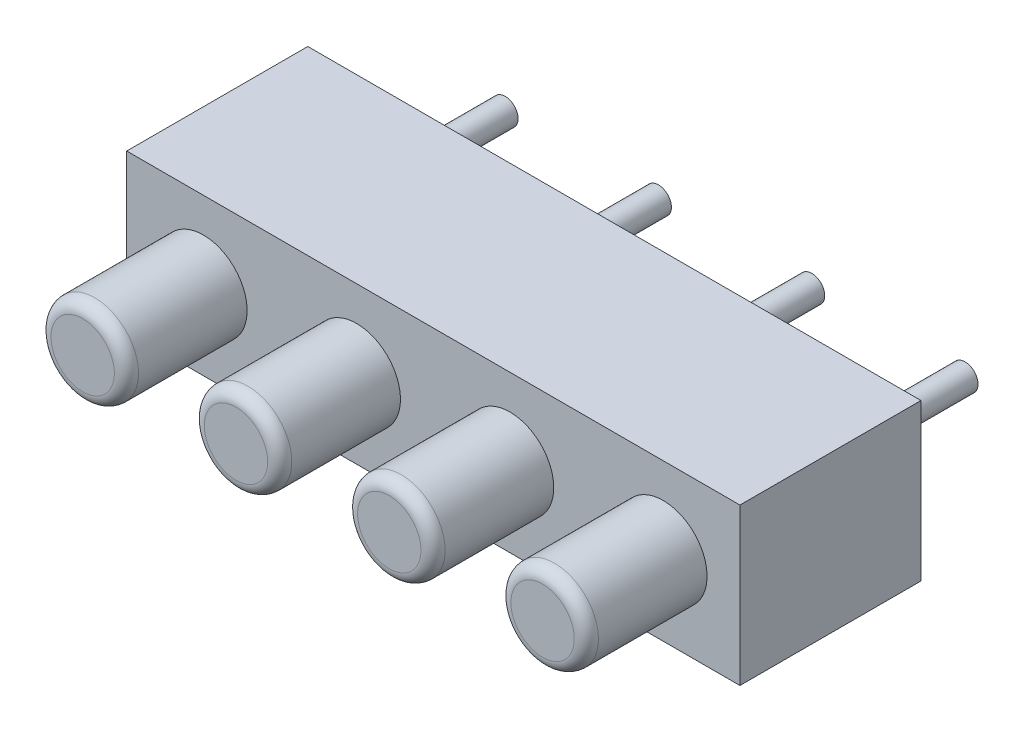
from build123d import *

# Parameters (mm, degrees)
SKETCH_1_W      = 10.16
SKETCH_1_H      = 2.59
EXTRUDE_1_DEPTH = 3
SKETCH_2_R      = 0.725
EXTRUDE_2_DEPTH = 2
SKETCH_3_R      = 0.215
EXTRUDE_3_DEPTH = 2
FILLET_1_R      = 0.2


with BuildPart() as part:
    # Эскиз1 → Бобышка-Вытянуть1 (new body)
    with BuildSketch(Plane.XY):
        with Locations((5.08, 1.295)):
            Rectangle(SKETCH_1_W, SKETCH_1_H)
    extrude(amount=EXTRUDE_1_DEPTH)

    # Эскиз2 → Бобышка-Вытянуть2 (add)
    with BuildSketch(Plane.XY.offset(3)):
        with Locations(Location((1.27, 1.295, 0), (0, 0, 180))):
            Circle(SKETCH_2_R)
        with Locations(Location((3.81, 1.295, 0), (0, 0, 180))):
            Circle(SKETCH_2_R)
        with Locations(Location((6.35, 1.295, 0), (0, 0, 180))):
            Circle(SKETCH_2_R)
        with Locations(Location((8.89, 1.295, 0), (0, 0, 180))):
            Circle(SKETCH_2_R)
    extrude(amount=EXTRUDE_2_DEPTH)

    # Эскиз3 → Бобышка-Вытянуть3 (add)
    with BuildSketch(Plane(origin=(0, 0, 0), x_dir=(-1, 0, 0), z_dir=(0, 0, -1))):
        with Locations((-1.27, 1.295)):
            Circle(SKETCH_3_R)
        with Locations((-3.81, 1.295)):
            Circle(SKETCH_3_R)
        with Locations((-6.35, 1.295)):
            Circle(SKETCH_3_R)
        with Locations((-8.89, 1.295)):
            Circle(SKETCH_3_R)
    extrude(amount=EXTRUDE_3_DEPTH)

    # Скругление1
    fillet_1_edges = [part.edges().sort_by_distance(p)[0] for p in [
        (1.995, 1.295, 5),
        (4.535, 1.295, 5),
        (7.075, 1.295, 5),
        (9.615, 1.295, 5),
    ]]
    fillet(fillet_1_edges, radius=FILLET_1_R)


solid = part.part
